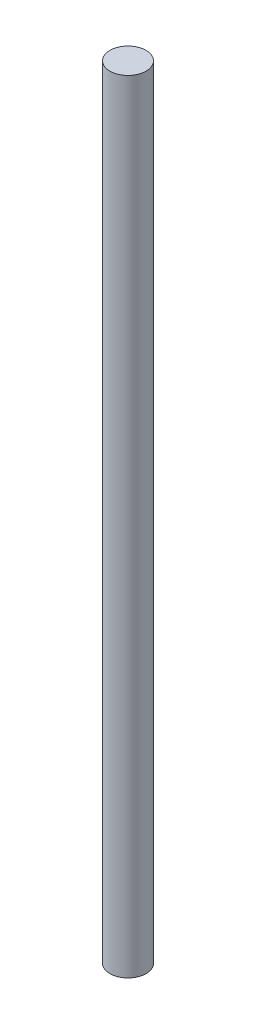
from build123d import *

# Parameters (mm, degrees)
SKETCH_1_R      = 3
EXTRUDE_1_DEPTH = 130


with BuildPart() as part:
    # Эскиз1 → Бобышка-Вытянуть1 (new body)
    with BuildSketch(Plane(origin=(0, 0, 0), x_dir=(1, 0, 0), z_dir=(0, 1, 0))):
        with Locations(Location((0, 0, 0), (0, 0, 270))):
            Circle(SKETCH_1_R)
    extrude(amount=EXTRUDE_1_DEPTH)


solid = part.part
